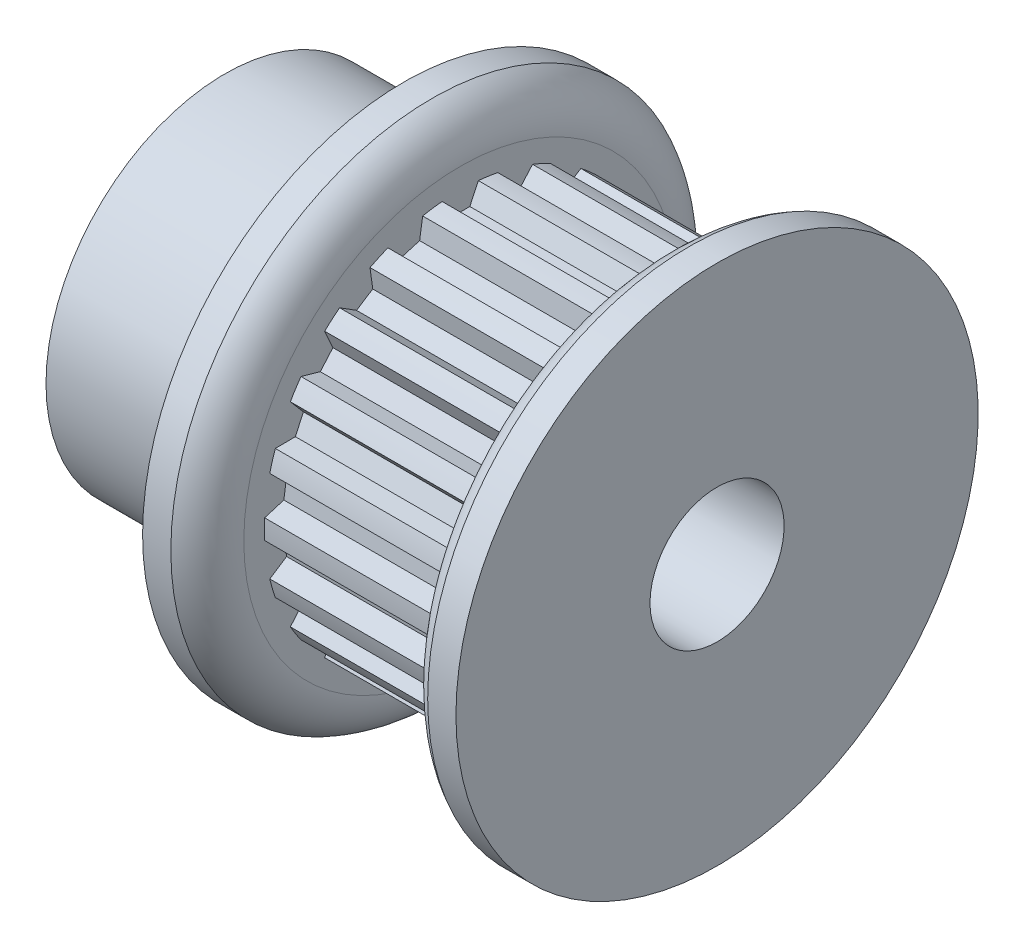
from build123d import *

# Parameters (mm, degrees)
SKETCH4_R          = 7.112
SKETCH4_R_2        = 6.95325
CUT_EXTRUDE2_DEPTH = 7.112
CUT_EXTRUDE1_DEPTH = 7.112
CIRPATTERN1_COUNT  = 22


with BuildPart() as part:
    # Sketch1 → Revolve1 (revolve)
    with BuildSketch(Plane.XY, mode=Mode.PRIVATE) as revolve1_sk:
        with BuildLine():
            Line((-8.7376, 2.38125), (8.7376, 2.38125))
            Line((8.7376, 2.38125), (8.7376, 9.271))
            Line((8.7376, 9.271), (7.7343, 9.271))
            ThreePointArc((7.7343, 9.271), (7.002848665, 8.622484443), (6.731, 7.6835))
            Line((6.731, 7.6835), (6.731, 7.112))
            Line((6.731, 7.112), (-0.381, 7.112))
            Line((-0.381, 7.112), (-0.381, 7.6835))
            ThreePointArc((-0.381, 7.6835), (-0.652848665, 8.622484443), (-1.3843, 9.271))
            Line((-1.3843, 9.271), (-2.3876, 9.271))
            Line((-2.3876, 9.271), (-2.3876, 6.35))
            Line((-2.3876, 6.35), (-8.7376, 6.35))
            Line((-8.7376, 6.35), (-8.7376, 2.38125))
        make_face()
    revolve(revolve1_sk.sketch.rotate(Axis((-8.7376, 0, 0), (1, 0, 0)), 90), axis=Axis((-8.7376, 0, 0), (1, 0, 0)))

    # Sketch4 → Cut-Extrude2 (cut)
    with BuildSketch(Plane(origin=(-0.381, 0, 0), x_dir=(0, 0, -1), z_dir=(1, 0, 0))):
        Circle(SKETCH4_R)
        Circle(SKETCH4_R_2, mode=Mode.SUBTRACT)
    extrude(amount=CUT_EXTRUDE2_DEPTH, mode=Mode.SUBTRACT)

    # Sketch3 → Cut-Extrude1 (cut)
    with BuildSketch(Plane(origin=(-0.381, 0, 0), x_dir=(0, 0, -1), z_dir=(1, 0, 0))):
        with BuildLine():
            Line((-0.642866361, 6.923467946), (-0.341514479, 6.277216749))
            Line((-0.341514479, 6.277216749), (0.341514479, 6.277216749))
            Line((0.341514479, 6.277216749), (0.642866361, 6.923467946))
            ThreePointArc((0.642866361, 6.923467946), (0, 6.95325), (-0.642866361, 6.923467946))
        make_face()
    cut_extrude1 = extrude(amount=CUT_EXTRUDE1_DEPTH, mode=Mode.SUBTRACT)

    # CirPattern1: Cut-Extrude1 ×22 about axis
    cirpattern1_axis = Axis((0, 0, 0), (1, 0, 0))
    for i in range(1, CIRPATTERN1_COUNT):
        add(cut_extrude1.rotate(cirpattern1_axis, i * 360 / CIRPATTERN1_COUNT), mode=Mode.SUBTRACT)


solid = part.part
